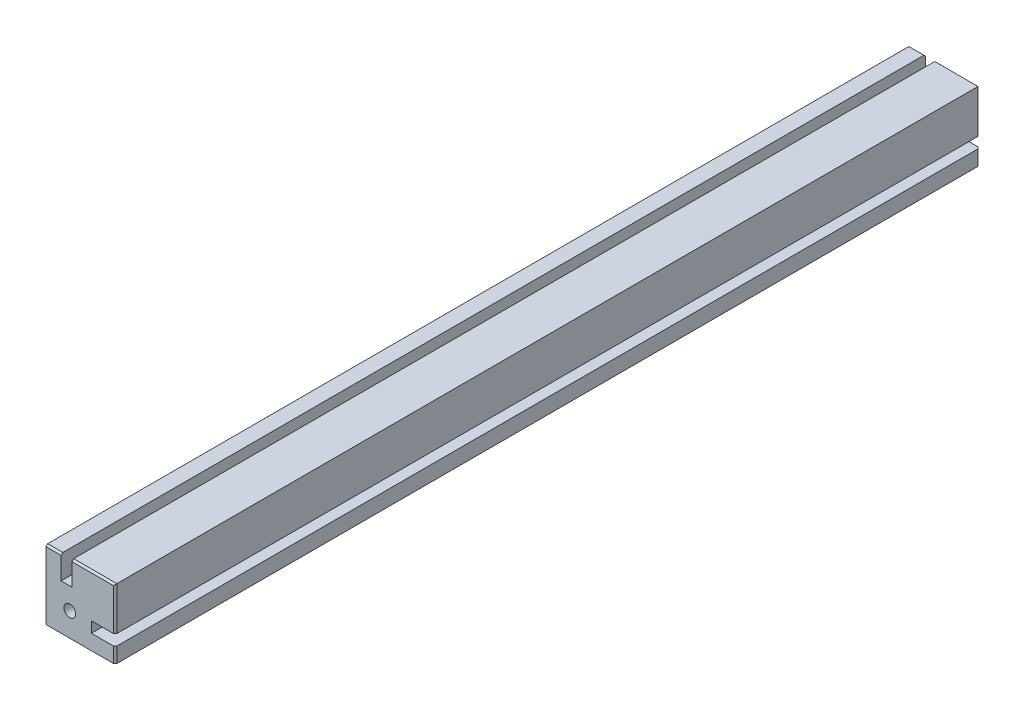
from build123d import *

# Parameters (mm, degrees)
ESQUISSE1_W                      = 16
ESQUISSE1_H                      = 16
BOSS_EXTRU_1_DEPTH               = 200
ESQUISSE2_W                      = 2.5
ESQUISSE2_H                      = 5.5
ESQUISSE2_W_2                    = 5.5
ESQUISSE2_H_2                    = 2.5
ENL_V_MAT_EXTRU_1_DEPTH          = 201.319744409
CHANFREIN1_SIZE                  = 0.4
D_GAGEMENT_M2_51_D               = 2.7
D_GAGEMENT_M2_51_DEPTH           = 14.188838164
D_GAGEMENT_M2_51_TIP             = 0.811161836
D_GAGEMENT_M2_51_ON_FACE_2_D     = 2.7
D_GAGEMENT_M2_51_ON_FACE_2_DEPTH = 14.188838164
D_GAGEMENT_M2_51_ON_FACE_2_TIP   = 0.811161836


with BuildPart() as part:
    # Esquisse1 → Boss.-Extru.1 (new body)
    with BuildSketch(Plane.XY):
        Rectangle(ESQUISSE1_W, ESQUISSE1_H)
    extrude(amount=BOSS_EXTRU_1_DEPTH)

    # Esquisse2 → Enlèv. mat.-Extru.1 (cut, through all)
    with BuildSketch(Plane.XY.offset(200)):
        with Locations((-3.25, 5.25)):
            Rectangle(ESQUISSE2_W, ESQUISSE2_H)
        with Locations((5.25, -3.25)):
            Rectangle(ESQUISSE2_W_2, ESQUISSE2_H_2)
    extrude(amount=-ENL_V_MAT_EXTRU_1_DEPTH, mode=Mode.SUBTRACT)

    # Chanfrein1
    chanfrein1_edges = [part.edges().sort_by_distance(p)[0] for p in [
        (8, 3, 0),
        (-6.25, 8, 0),
        (8, 3, 200),
        (-6.25, 8, 200),
        (8, -6.25, 200),
        (3, 8, 0),
        (8, -6.25, 0),
        (3, 8, 200),
    ]]
    chamfer(chanfrein1_edges, length=CHANFREIN1_SIZE)

    # Dégagement M2.51
    with Locations(Plane(origin=(-2.5, -2.5, 200), x_dir=(1, 0, 0), z_dir=(0, 0, 1))):
        with Locations((0, 0)):
            Hole(D_GAGEMENT_M2_51_D / 2, depth=D_GAGEMENT_M2_51_DEPTH)
            with Locations((0, 0, -(D_GAGEMENT_M2_51_DEPTH + D_GAGEMENT_M2_51_TIP / 2))):  # 118° drill point
                Cone(0, D_GAGEMENT_M2_51_D / 2, D_GAGEMENT_M2_51_TIP, mode=Mode.SUBTRACT)

    # Dégagement M2.51 on face 2
    with Locations(Plane(origin=(-2.5, -2.5, 0), x_dir=(-1, 0, 0), z_dir=(0, 0, -1))):
        with Locations((0, 0)):
            Hole(D_GAGEMENT_M2_51_ON_FACE_2_D / 2, depth=D_GAGEMENT_M2_51_ON_FACE_2_DEPTH)
            with Locations((0, 0, -(D_GAGEMENT_M2_51_ON_FACE_2_DEPTH + D_GAGEMENT_M2_51_ON_FACE_2_TIP / 2))):  # 118° drill point
                Cone(0, D_GAGEMENT_M2_51_ON_FACE_2_D / 2, D_GAGEMENT_M2_51_ON_FACE_2_TIP, mode=Mode.SUBTRACT)


solid = part.part
